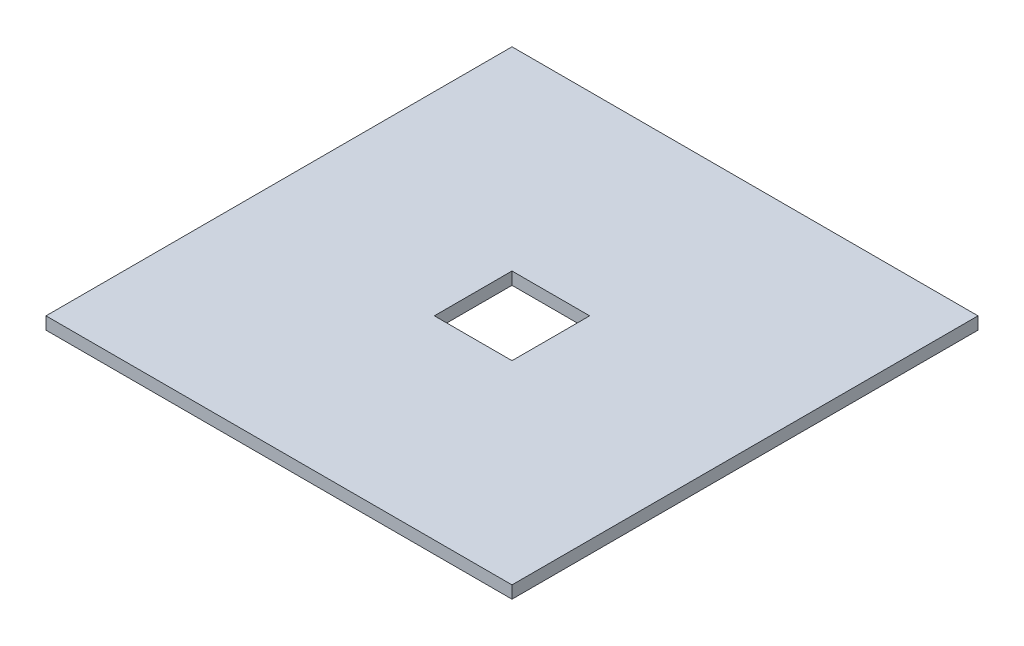
from build123d import *

# Parameters (mm, degrees)
SKETCH1_W           = 300
SKETCH1_H           = 300
BOSS_EXTRUDE1_DEPTH = 8
SKETCH2_W           = 50
SKETCH2_H           = 50
CUT_EXTRUDE1_DEPTH  = 10


with BuildPart() as part:
    # Sketch1 → Boss-Extrude1 (new body)
    with BuildSketch(Plane(origin=(0, 0, 0), x_dir=(1, 0, 0), z_dir=(0, 1, 0))):
        Rectangle(SKETCH1_W, SKETCH1_H)
    extrude(amount=BOSS_EXTRUDE1_DEPTH)

    # Sketch2 → Cut-Extrude1 (cut)
    with BuildSketch(Plane(origin=(0, 8, 0), x_dir=(1, 0, 0), z_dir=(0, 1, 0))):
        Rectangle(SKETCH2_W, SKETCH2_H)
    extrude(amount=-CUT_EXTRUDE1_DEPTH, mode=Mode.SUBTRACT)


solid = part.part
